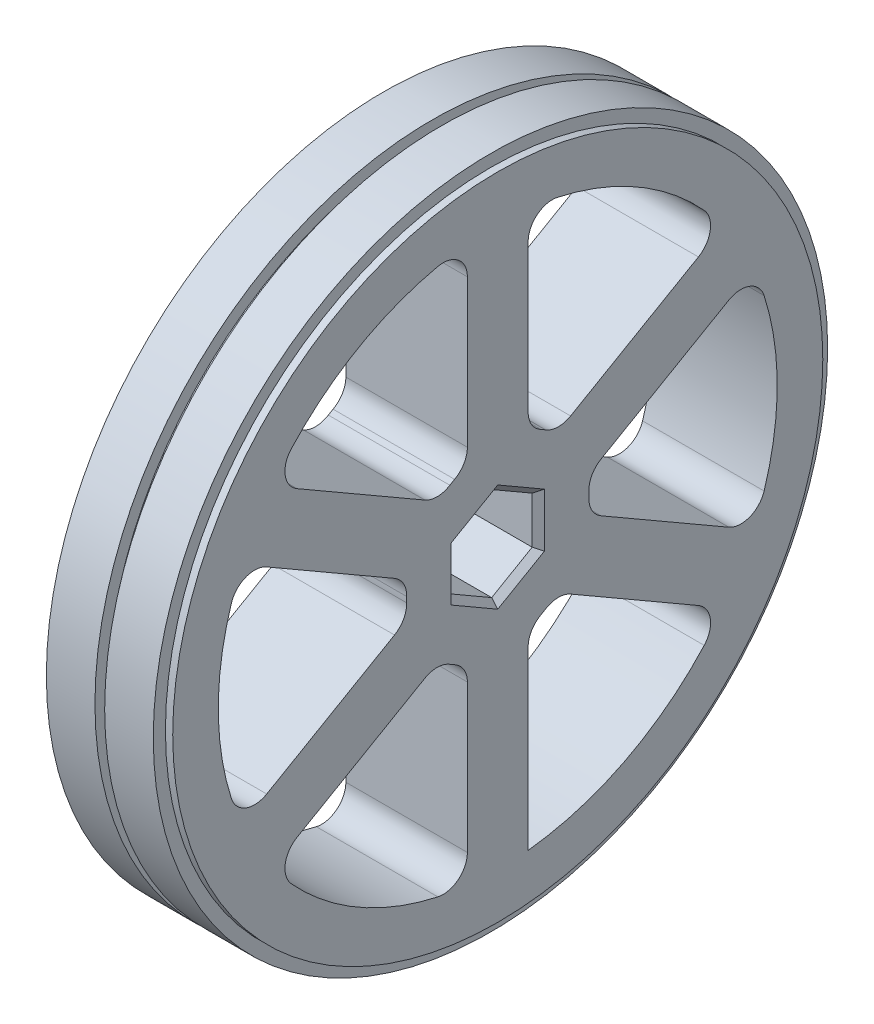
from build123d import *

# Parameters (mm, degrees)
AXLE_PROFILE_R              = 9.525
WHEEL_HUB_DEPTH             = 12.7
WHEEL_RIM_REACH             = 16.892
SKETCH3_R                   = 33.9725
SKETCH3_R_2                 = 29.21
WHEEL_RIM_DIRECTION_2_REACH = 16.892
SKETCH4_W                   = 6.35
SKETCH4_H                   = 20.229743879
BOSS_EXTRUDE1_DEPTH         = 12.7
SPOKES_COUNT                = 6
SPOKE_FILLETS_R             = 2.54
SHAFT_CHAMFERS_SIZE         = 0.635
EXTRUDE_THIN1_START         = 0.508
SKETCH6_R                   = 35.2425
SKETCH6_R_2                 = 33.9725
EXTRUDE_THIN1_DEPTH         = 5.08


with BuildPart() as part:
    # Axle Profile → Wheel Hub (new body)
    with BuildSketch(Plane(origin=(0, 0, 0), x_dir=(0, 0, -1), z_dir=(1, 0, 0))):
        Circle(AXLE_PROFILE_R)
        Polygon((0, -4.8895), (4.234431212, -2.44475), (4.234431212, 2.44475), (0, 4.8895), (-4.234431212, 2.44475), (-4.234431212, -2.44475), align=None, mode=Mode.SUBTRACT)
    extrude(amount=WHEEL_HUB_DEPTH)

    # Wheel Rim: up to this face of the body (flat: up to its plane)
    wheel_rim_end = Plane(part.part.faces().sort_by_distance((0, 0, 9.255592316))[0])
    # Sketch3 → Wheel Rim (add, up to the picked face)
    with BuildSketch(Plane.ZY.offset(-6.35), mode=Mode.PRIVATE) as wheel_rim_sk1:
        with Locations(Location((0, 0, 0), (0, 0, 180))):
            Circle(SKETCH3_R)
        with Locations(Location((0, 0, 0), (0, 0, 180))):
            Circle(SKETCH3_R_2, mode=Mode.SUBTRACT)
    wheel_rim_tool1 = split(extrude(wheel_rim_sk1.sketch, amount=WHEEL_RIM_REACH, mode=Mode.PRIVATE), bisect_by=wheel_rim_end, keep=Keep.BOTH, mode=Mode.PRIVATE)
    add(wheel_rim_tool1.solids().sort_by(Axis((6.35, 0, 33.011613), (-1, 0, 0)))[0])

    # Wheel Rim direction 2: up to this face of the body (flat: up to its plane)
    wheel_rim_direction_2_end = Plane(part.part.faces().sort_by_distance((12.7, 0, 9.255592316))[0])
    # Sketch3 → Wheel Rim direction 2 (add, up to the picked face)
    with BuildSketch(Plane.ZY.offset(-6.35), mode=Mode.PRIVATE) as wheel_rim_direction_2_sk1:
        with Locations(Location((0, 0, 0), (0, 0, 180))):
            Circle(SKETCH3_R)
        with Locations(Location((0, 0, 0), (0, 0, 180))):
            Circle(SKETCH3_R_2, mode=Mode.SUBTRACT)
    wheel_rim_direction_2_tool1 = split(extrude(wheel_rim_direction_2_sk1.sketch, amount=-WHEEL_RIM_DIRECTION_2_REACH, mode=Mode.PRIVATE), bisect_by=wheel_rim_direction_2_end, keep=Keep.BOTH, mode=Mode.PRIVATE)
    add(wheel_rim_direction_2_tool1.solids().sort_by(Axis((6.35, 0, 33.011613), (1, 0, 0)))[0])

    # Sketch4 → Boss-Extrude1 (add)
    with BuildSketch(Plane(origin=(12.7, 0, 0), x_dir=(0, 0, -1), z_dir=(1, 0, 0))):
        with Locations((0, 19.095128061)):
            Rectangle(SKETCH4_W, SKETCH4_H)
    boss_extrude1 = extrude(amount=-BOSS_EXTRUDE1_DEPTH)

    # Spokes: Boss-Extrude1 ×6 about axis
    spokes_axis = Axis((0, 0, 0), (1, 0, 0))
    for i in range(1, SPOKES_COUNT):
        add(boss_extrude1.rotate(spokes_axis, i * 360 / SPOKES_COUNT))

    # Spoke Fillets
    spoke_fillets_edges = [part.edges().sort_by_distance(p)[0] for p in [
        (6.35, 7.239758718, -6.189629933),
        (6.35, 1.740497404, -9.364629933),
        (6.35, -1.740497404, -9.364629933),
        (6.35, -7.239758718, -6.189629933),
        (6.35, -8.980256121, -3.175),
        (6.35, -8.980256121, 3.175),
        (6.35, -7.239758718, 6.189629933),
        (6.35, -1.740497404, 9.364629933),
        (6.35, 1.740497404, 9.364629933),
        (6.35, 7.239758718, 6.189629933),
        (6.35, 8.980256121, 3.175),
        (6.35, 8.980256121, -3.175),
        (9.525, 29.036932948, -3.175),
        (9.525, 29.036932948, 3.175),
        (3.175, 17.268097131, 23.559221581),
        (3.175, 11.768835817, 26.734221581),
        (9.525, -11.768835817, 26.734221581),
        (9.525, -17.268097131, 23.559221581),
        (9.525, -29.036932948, 3.175),
        (3.175, -17.268097131, -23.559221581),
        (3.175, -11.768835817, -26.734221581),
        (9.525, 11.768835817, -26.734221581),
        (3.175, 17.268097131, -23.559221581),
    ]]
    fillet(spoke_fillets_edges, radius=SPOKE_FILLETS_R)

    # Shaft Chamfers
    shaft_chamfers_edges = [part.edges().sort_by_distance(p)[0] for p in [
        (0, 0, -4.234431212),
        (0, 3.667125, -2.117215606),
        (0, 3.667125, 2.117215606),
        (0, 0, 4.234431212),
        (12.7, -3.667125, 2.117215606),
        (12.7, -3.667125, -2.117215606),
        (12.7, 0, -4.234431212),
        (12.7, 3.667125, -2.117215606),
        (12.7, 3.667125, 2.117215606),
        (12.7, 0, 4.234431212),
        (0, -3.667125, 2.117215606),
        (0, -3.667125, -2.117215606),
    ]]
    chamfer(shaft_chamfers_edges, length=SHAFT_CHAMFERS_SIZE)


with BuildPart() as body_2:
    # Sketch6 → Extrude-Thin1 (new body)
    with BuildSketch(Plane.ZY.offset(-6.35).offset(EXTRUDE_THIN1_START)):
        Circle(SKETCH6_R)
        Circle(SKETCH6_R_2, mode=Mode.SUBTRACT)
    extrude(amount=EXTRUDE_THIN1_DEPTH)


with BuildPart() as body_3:
    # Mirror1: mirrored copy
    add(body_2.part.mirror(Plane.ZY.offset(-6.35)))


solid = Compound([part.part, body_2.part, body_3.part])
